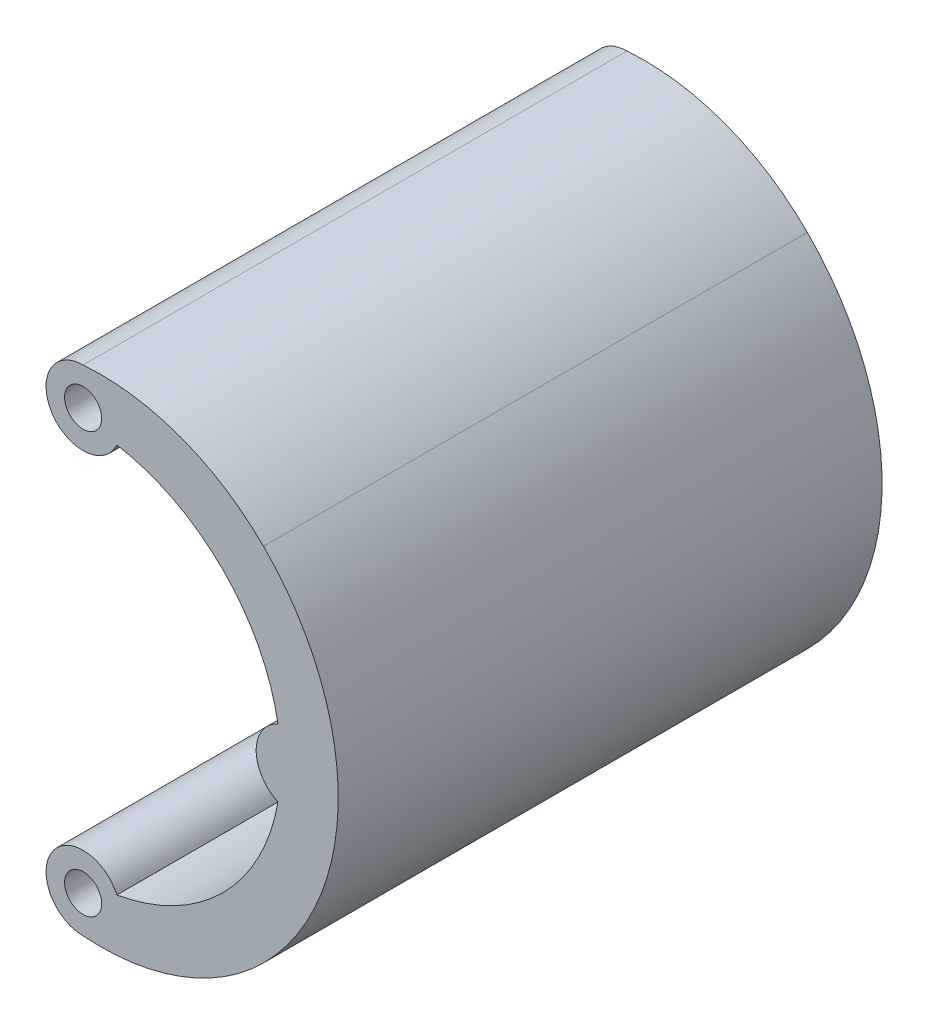
from build123d import *

# Parameters (mm, degrees)
BOSS_EXTRUDE1_DEPTH             = 44
F_3_0MM_DOWEL_HOLE1_D           = 3
F_3_0MM_DOWEL_HOLE1_CSINK_D     = 3.05
F_3_0MM_DOWEL_HOLE1_CSINK_ANGLE = 100


with BuildPart() as part:
    # Sketch1 → Boss-Extrude1 (new body)
    with BuildSketch(Plane(origin=(0, 0, 0), x_dir=(0, 1, 0), z_dir=(0, 0, 1))):
        with BuildLine():
            ThreePointArc((14.594339842, -14.594339842), (18.893257917, -7.888351803), (20, 0))
            ThreePointArc((20, 0), (15.373021566, 2.520504151), (15.764705882, -2.733870597))
            ThreePointArc((15.764705882, -2.733870597), (11.313708499, -11.313708499), (2.733870597, -15.764705882))
            ThreePointArc((2.733870597, -15.764705882), (0, -14), (-2.733870597, -15.764705882))
            ThreePointArc((-2.733870597, -15.764705882), (-11.313708499, -11.313708499), (-15.764705882, -2.733870597))
            ThreePointArc((-15.764705882, -2.733870597), (-15.373021566, 2.520504151), (-20, 0))
            ThreePointArc((-20, 0), (-18.893257917, -7.888351803), (-14.594339842, -14.594339842))
            ThreePointArc((-14.594339842, -14.594339842), (0, -20.639513339), (14.594339842, -14.594339842))
        make_face()
    extrude(amount=BOSS_EXTRUDE1_DEPTH)

    # Ø3.0mm Dowel Hole1 (through all)
    with Locations(Plane(origin=(0, 0, 0), x_dir=(1, 0, 0), z_dir=(0, 0, -1))):
        with Locations((0, -17), (0, 17)):
            CounterSinkHole(F_3_0MM_DOWEL_HOLE1_D / 2, F_3_0MM_DOWEL_HOLE1_CSINK_D / 2, counter_sink_angle=F_3_0MM_DOWEL_HOLE1_CSINK_ANGLE)


solid = part.part
